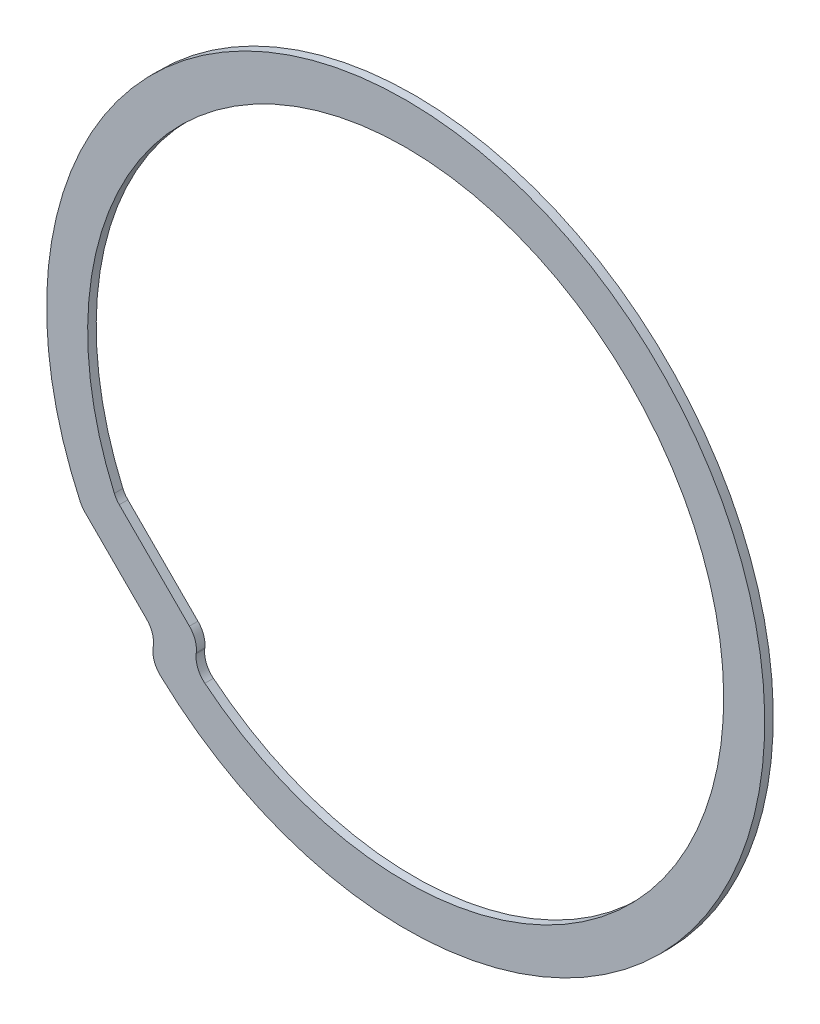
from build123d import *

# Parameters (mm, degrees)
BOSS_EXTRUDE1_DEPTH = 1.5875
CUT_EXTRUDE1_DEPTH  = 3.175
FILLET1_R           = 8.89


with BuildPart() as part:
    # Sketch1 → Boss-Extrude1 (new, symmetric)
    with BuildSketch(Plane.XY):
        with BuildLine():
            Line((-120.187952283, -34.272453), (-93.24718392, -61.213221363))
            Line((-93.24718392, -61.213221363), (-94.292689271, -70.797689271))
            ThreePointArc((-94.292689271, -70.797689271), (-77.124658044, -85.289234251), (-57.767453, -96.692952283))
            ThreePointArc((-57.767453, -96.692952283), (94.292689271, 117.787689271), (-120.187952283, -34.272453))
        make_face()
    extrude(amount=BOSS_EXTRUDE1_DEPTH, both=True)

    # Sketch2 → Cut-Extrude1 (cut)
    with BuildSketch(Plane.XY.offset(1.5875)):
        with BuildLine():
            Line((-77.304798152, -55.60299244), (-78.320318415, -64.912577861))
            ThreePointArc((-78.320318415, -64.912577861), (94.997930523, 93.675946819), (-107.51910025, -25.388690342))
            Line((-107.51910025, -25.388690342), (-77.304798152, -55.60299244))
        make_face()
    extrude(amount=-CUT_EXTRUDE1_DEPTH, mode=Mode.SUBTRACT)

    # Fillet1
    fillet1_edges = [part.edges().sort_by_distance(p)[0] for p in [
        (-77.304798152, -55.60299244, 0),
        (-107.51910025, -25.388690342, 0),
        (-78.320318415, -64.912577861, 0),
        (-93.24718392, -61.213221363, -0.79375),
        (-120.187952283, -34.272453, -0.79375),
        (-94.292689271, -70.797689271, -0.79375),
    ]]
    fillet(fillet1_edges, radius=FILLET1_R)


solid = part.part
